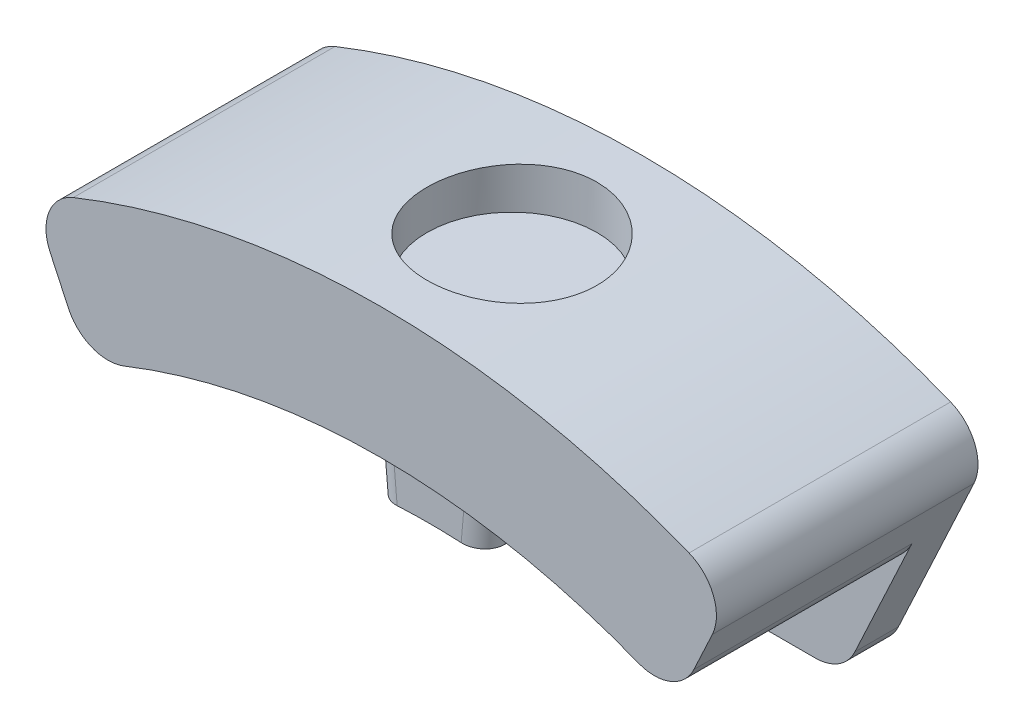
from build123d import *

# Parameters (mm, degrees)
EXTRUDE_1_DEPTH      = 5
SKETCH_2_W           = 1.8
SKETCH_2_H           = 3.7
REVOLVE_1_ANGLE      = 5
FILLET_1_R           = 0.5
FILLET_2_R           = 1
FILLET_3_R           = 1
SKETCH_4_W           = 4
SKETCH_4_H           = 2
CUT_EXTRUDE_1_DEPTH  = 4
EXTRUDE_5_REACH      = 11.968
EXTRUDE_5_END_RADIUS = 19
SKETCH_5_W           = 4
SKETCH_5_H           = 4
SKETCH_5_R           = 1.95
EXTRUDE_6_DEPTH      = 1
FILLET_5_R           = 1


with BuildPart() as part:
    # 草图1 → 凸台-拉伸1 (new body)
    with BuildSketch(Plane.XY):
        with BuildLine():
            Line((-8.029746973, 17.219847954), (-6.761892188, 14.500924593))
            ThreePointArc((-6.761892188, 14.500924593), (0, 16), (6.761892188, 14.500924593))
            Line((6.761892188, 14.500924593), (8.029746973, 17.219847954))
            ThreePointArc((8.029746973, 17.219847954), (0, 19), (-8.029746973, 17.219847954))
        make_face()
    extrude(amount=EXTRUDE_1_DEPTH)

    # 草图2 → 旋转1 (revolve)
    with BuildSketch(Plane(origin=(0, 0, 0), x_dir=(0, 0, -1), z_dir=(1, 0, 0))):
        with Locations((-3, 16)):
            Rectangle(SKETCH_2_W, SKETCH_2_H)
    revolve_1 = revolve(axis=Axis((0, 0, 5), (0, 0, -1)), revolution_arc=REVOLVE_1_ANGLE)

    # 镜向1: 旋转1 across plane
    add(revolve_1.mirror(Plane(origin=(0, 0, 0), x_dir=(0, 0, 1), z_dir=(1, 0, 0))))

    # 圆角1
    fillet_1_edges = [part.edges().sort_by_distance(p)[0] for p in [
        (1.313872822, 15.017635074, 3.9),
        (1.313872822, 15.017635074, 2.1),
        (-1.313872822, 15.017635074, 2.1),
        (-1.313872822, 15.017635074, 3.9),
    ]]
    fillet(fillet_1_edges, radius=FILLET_1_R)

    # 圆角2
    fillet_2_edges = [part.edges().sort_by_distance(p)[0] for p in [
        (-6.761892188, 14.500924593, 2.5),
        (6.761892188, 14.500924593, 2.5),
    ]]
    fillet(fillet_2_edges, radius=FILLET_2_R)

    # 圆角3
    fillet_3_edges = [part.edges().sort_by_distance(p)[0] for p in [
        (-8.029746973, 17.219847954, 2.5),
        (8.029746973, 17.219847954, 2.5),
    ]]
    fillet(fillet_3_edges, radius=FILLET_3_R)

    # 草图4 → 切除-拉伸1 (cut)
    with BuildSketch(Plane(origin=(0, 0, 0), x_dir=(-1, 0, 0), z_dir=(0, 0, -1))):
        with Locations((0, 19)):
            Rectangle(SKETCH_4_W, SKETCH_4_H)
    extrude(amount=-CUT_EXTRUDE_1_DEPTH, mode=Mode.SUBTRACT)

    # 凸台-拉伸5: up to this cylinder (the profile starts inside it)
    extrude_5_end = Plane(origin=(0, 0, 3.994343), z_dir=(0, 0, -1)) * Cylinder(EXTRUDE_5_END_RADIUS, 62.936, mode=Mode.PRIVATE)
    # 草图5 → 凸台-拉伸5 (add, up to the surface)
    with BuildSketch(Plane(origin=(0, 18, 0), x_dir=(1, 0, 0), z_dir=(0, 1, 0)), mode=Mode.PRIVATE) as extrude_5_sk1:
        with Locations((0, -2)):
            Rectangle(SKETCH_5_W, SKETCH_5_H)
        with Locations(Location((0, -2, 0), (0, 0, 90))):
            Circle(SKETCH_5_R, mode=Mode.SUBTRACT)
    extrude_5_tool1 = extrude(extrude_5_sk1.sketch, amount=EXTRUDE_5_REACH, mode=Mode.PRIVATE) & extrude_5_end
    add(extrude_5_tool1.solids().sort_by_distance((0, 18, 3.994343))[0])

    # 草图6 → 凸台-拉伸6 (add)
    with BuildSketch(Plane(origin=(0, 0, 0), x_dir=(-1, 0, 0), z_dir=(0, 0, -1))):
        with BuildLine():
            Line((-7.595380243, 16.288345495), (-5.595691898, 12))
            Line((-5.595691898, 12), (5.595691898, 12))
            Line((5.595691898, 12), (7.595380243, 16.288345495))
            ThreePointArc((7.595380243, 16.288345495), (7.618897961, 17.078964477), (7.060687592, 17.639350632))
            ThreePointArc((7.060687592, 17.639350632), (0, 19), (-7.060687592, 17.639350632))
            ThreePointArc((-7.060687592, 17.639350632), (-7.618897961, 17.078964477), (-7.595380243, 16.288345495))
        make_face()
    extrude(amount=EXTRUDE_6_DEPTH)

    # 圆角5
    fillet_5_edges = [part.edges().sort_by_distance(p)[0] for p in [
        (5.595691898, 12, -0.5),
        (-5.595691898, 12, -0.5),
    ]]
    fillet(fillet_5_edges, radius=FILLET_5_R)


solid = part.part
